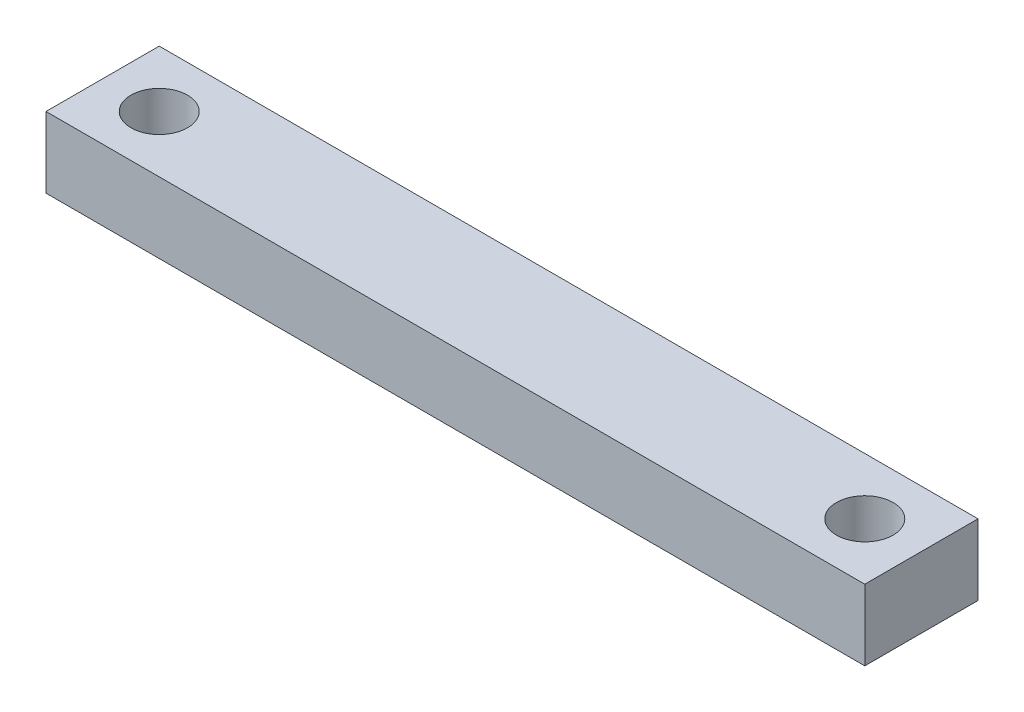
from build123d import *

# Parameters (mm, degrees)
SKETCH1_W           = 57.85
SKETCH1_H           = 8
SKETCH1_R           = 2
BOSS_EXTRUDE1_DEPTH = 5


with BuildPart() as part:
    # Sketch1 → Boss-Extrude1 (new body)
    with BuildSketch(Plane(origin=(0, 0, 0), x_dir=(1, 0, 0), z_dir=(0, 1, 0))):
        with Locations((28.925, 4)):
            Rectangle(SKETCH1_W, SKETCH1_H)
        with Locations(Location((4, 4, 0), (0, 0, 270))):
            Circle(SKETCH1_R, mode=Mode.SUBTRACT)
        with Locations(Location((53.85, 4, 0), (0, 0, 270))):
            Circle(SKETCH1_R, mode=Mode.SUBTRACT)
    extrude(amount=BOSS_EXTRUDE1_DEPTH)


solid = part.part
